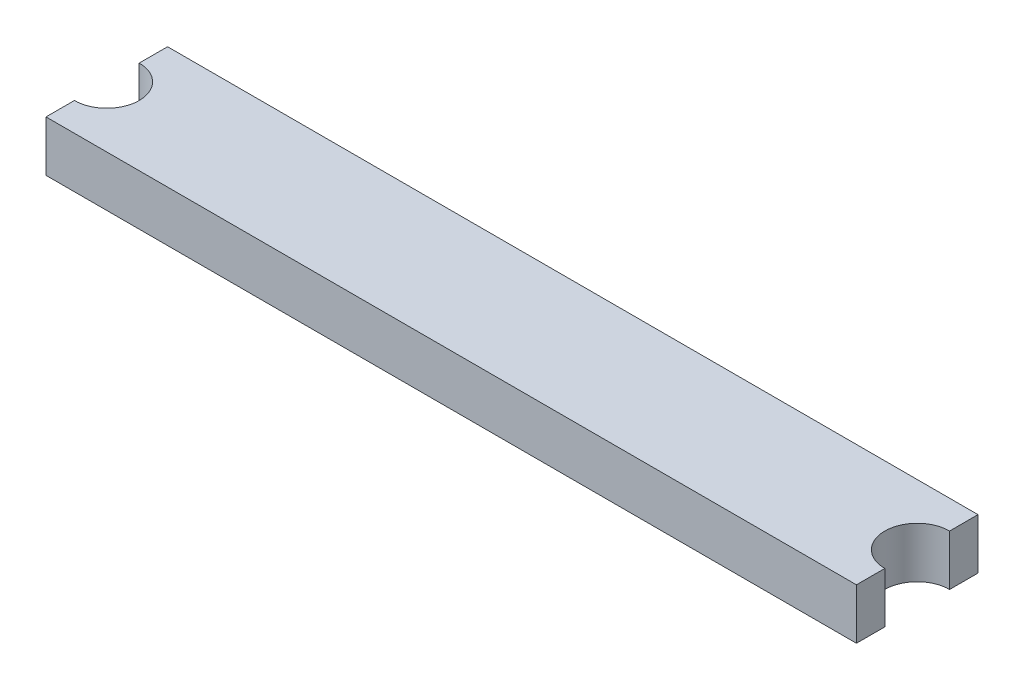
from build123d import *

# Parameters (mm, degrees)
SKETCH2_W           = 400
SKETCH2_H           = 60
BOSS_EXTRUDE1_DEPTH = 25
SKETCH3_R           = 16
CUT_EXTRUDE2_DEPTH  = 204.776838723


with BuildPart() as part:
    # Sketch2 → Boss-Extrude1 (new body)
    with BuildSketch(Plane(origin=(0, 0, 0), x_dir=(1, 0, 0), z_dir=(0, 1, 0))):
        Rectangle(SKETCH2_W, SKETCH2_H)
    extrude(amount=BOSS_EXTRUDE1_DEPTH)

    # Sketch3 → Cut-Extrude2 (cut, through all)
    with BuildSketch(Plane(origin=(0, 25, 0), x_dir=(1, 0, 0), z_dir=(0, 1, 0))):
        with Locations((-200, 0)):
            Circle(SKETCH3_R)
        with Locations((200, 0)):
            Circle(SKETCH3_R)
    extrude(amount=-CUT_EXTRUDE2_DEPTH, mode=Mode.SUBTRACT)


solid = part.part
